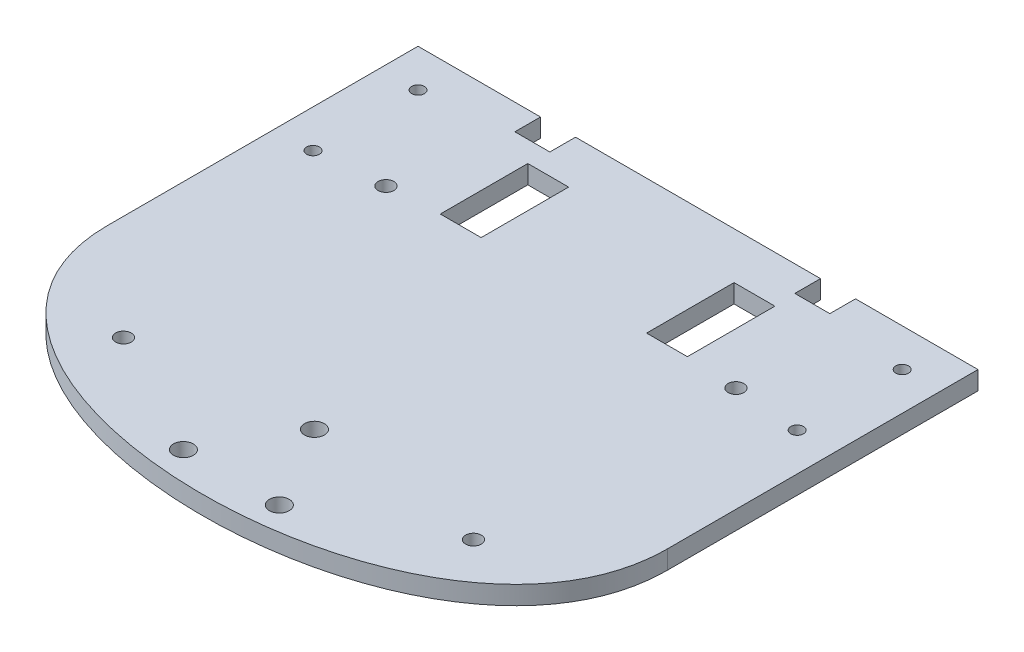
from build123d import *

# Parameters (mm, degrees)
BOSS_EXTRUDE1_DEPTH     = 3.175
CUT_EXTRUDE1_DEPTH      = 65.189801711
CUT_EXTRUDE1_DEPTH_BACK = 65.189801711
SKETCH3_R               = 1.0922
SKETCH3_R_2             = 1.35
SKETCH3_R_3             = 1.7
SKETCH3_W               = 7
SKETCH3_H               = 15
SKETCH5_W               = 6
SKETCH5_H               = 4.4
CUT_EXTRUDE2_DEPTH      = 65.189801711


with BuildPart() as part:
    # Sketch2 → Boss-Extrude1 (new body)
    with BuildSketch(Plane(origin=(0, 0, 0), x_dir=(1, 0, 0), z_dir=(0, 1, 0))):
        with BuildLine():
            Line((48, 42.5), (-48, 42.5))
            Line((-48, 42.5), (-48, -10.75))
            add(Edge.make_bspline(
                [(-48, -10.75), (-48, -53.083333333), (48, -53.083333333), (48, -10.75)],
                knots=[0, 0, 0, 0, 1, 1, 1, 1], degree=3))
            Line((48, -10.75), (48, 42.5))
        make_face()
    extrude(amount=BOSS_EXTRUDE1_DEPTH)

    # Sketch3 → Cut-Extrude1 (cut, two sides: drawn at the far end of the back side and taken through both)
    with BuildSketch(Plane(origin=(0, 3.175, 0), x_dir=(1, 0, 0), z_dir=(0, 1, 0)).offset(-CUT_EXTRUDE1_DEPTH_BACK)):
        with Locations(Location((-41.5, 36, 0), (0, 0, 270))):
            Circle(SKETCH3_R)
        with Locations(Location((-41.5, 18, 0), (0, 0, 270))):
            Circle(SKETCH3_R)
        with Locations(Location((-30, 19, 0), (0, 0, 270))):
            Circle(SKETCH3_R_2)
        with Locations(Location((41.5, 18, 0), (0, 0, 90))):
            Circle(SKETCH3_R)
        with Locations(Location((41.5, 36, 0), (0, 0, 90))):
            Circle(SKETCH3_R)
        with Locations(Location((-30, -26, 0), (0, 0, 270))):
            Circle(SKETCH3_R_2)
        with Locations(Location((30, -26, 0), (0, 0, 90))):
            Circle(SKETCH3_R_2)
        with Locations(Location((30, 19, 0), (0, 0, 90))):
            Circle(SKETCH3_R_2)
        with Locations(Location((-8.225, -37.5, 0), (0, 0, 270))):
            Circle(SKETCH3_R_3)
        with Locations(Location((8.225, -37.5, 0), (0, 0, 90))):
            Circle(SKETCH3_R_3)
        with Locations(Location((0, -23.253882108, 0), (0, 0, 90))):
            Circle(SKETCH3_R_3)
        with Locations((-17.68, 27)):
            Rectangle(SKETCH3_W, SKETCH3_H)
        with Locations((17.68, 27)):
            Rectangle(SKETCH3_W, SKETCH3_H)
    extrude(amount=CUT_EXTRUDE1_DEPTH + CUT_EXTRUDE1_DEPTH_BACK, mode=Mode.SUBTRACT)

    # Sketch5 → Cut-Extrude2 (cut, through all)
    with BuildSketch(Plane(origin=(0, 3.175, 0), x_dir=(1, 0, 0), z_dir=(0, 1, 0))):
        with Locations((24, 40.3)):
            Rectangle(SKETCH5_W, SKETCH5_H)
        with Locations((-24, 40.3)):
            Rectangle(SKETCH5_W, SKETCH5_H)
    extrude(amount=-CUT_EXTRUDE2_DEPTH, mode=Mode.SUBTRACT)


solid = part.part
